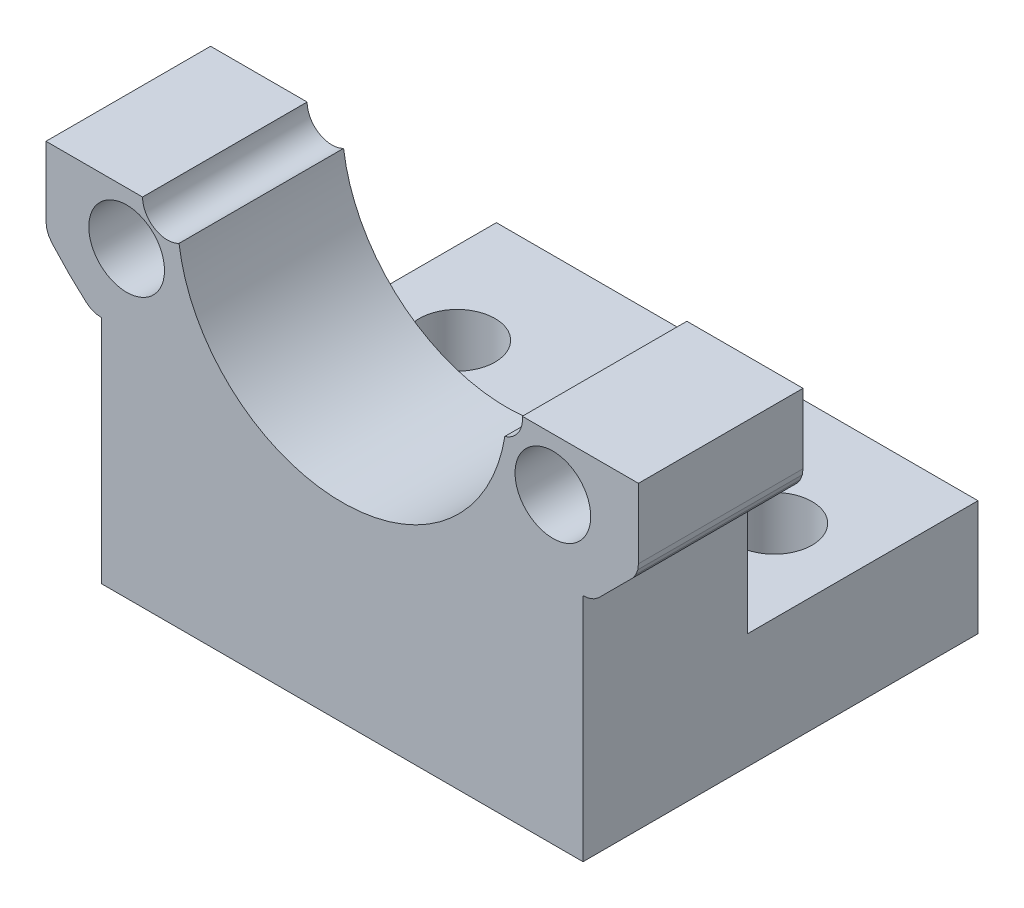
from build123d import *

# Parameters (mm, degrees)
FACE_2_DEPTH            = 5
SKETCH2_W               = 14.632926246
SKETCH2_H               = 5
BOSS_EXTRUDE2_DEPTH     = 7
SKETCH3_W               = 14.632926246
SKETCH3_H               = 7
BOSS_EXTRUDE3_DEPTH     = 7
EYE_HOLES_REACH         = 248.075
SKETCH4_R               = 1.15
SKETCH5_W               = 14.632926246
SKETCH5_H               = 3.5
SEAT_DEPTH              = 7
SKETCH6_W               = 18
SKETCH6_H               = 5
BOSS_EXTRUDE4_DEPTH     = 3.5
SKETCH7_W               = 18.025006546
SKETCH7_H               = 4.25
TOP_HOLE_DEPTH          = 248.972829901
MIDDLE_HOLE_DEPTH       = 246.672789516
MIDDLE_HOLE_DEPTH_BACK  = 246.672789516
SKETCH8_R               = 5.003684601
CUT_EXTRUDE8_DEPTH      = 208.598432106
CUT_EXTRUDE8_DEPTH_BACK = 3.5
SKETCH10_R              = 1.15
SKETCH11_R              = 0.754398486
CUT_EXTRUDE9_DEPTH      = 246.672789516


with BuildPart() as part:
    # Sketch1 → Face 2 (new body)
    with BuildSketch(Plane.XY):
        Polygon((189.199131389, 129.336090234), (189.219408928, 129.168352428), (189.276625012, 129.01501095), (189.375109043, 128.870497126), (189.879763338, 128.333185306), (190.417075159, 127.828531011), (190.558185088, 127.731803407), (190.715733881, 127.672634267), (190.882668266, 127.652553357), (205.515594512, 127.652553357), (205.683332318, 127.672830896), (205.84007769, 127.731803407), (205.98118762, 127.828531011), (207.023153735, 128.870497126), (207.118523911, 129.009007135), (207.17885385, 129.168352428), (207.199131389, 129.336090234), (207.199131389, 132.202042434), (189.199131389, 132.202042434), align=None)
    extrude(amount=FACE_2_DEPTH)

    # Sketch2 → Boss-Extrude2 (add)
    with BuildSketch(Plane.XZ.offset(-127.652553357)):
        with Locations((198.199131389, 2.5)):
            Rectangle(SKETCH2_W, SKETCH2_H)
    extrude(amount=BOSS_EXTRUDE2_DEPTH)

    # Sketch3 → Boss-Extrude3 (add)
    with BuildSketch(Plane(origin=(0, 0, 0), x_dir=(-1, 0, 0), z_dir=(0, 0, -1))):
        with Locations((-198.199131389, 124.152553357)):
            Rectangle(SKETCH3_W, SKETCH3_H)
    extrude(amount=BOSS_EXTRUDE3_DEPTH)

    # Sketch4 → Eye Holes (cut, up to next)
    with BuildSketch(Plane.XY.offset(5), mode=Mode.PRIVATE) as eye_holes_sk1:
        with Locations((191.649131389, 129.852042434)):
            Circle(SKETCH4_R)
    eye_holes_tool1 = extrude(eye_holes_sk1.sketch, amount=-EYE_HOLES_REACH, mode=Mode.PRIVATE) & part.part
    # Sketch4 → Eye Holes (cut, up to next)
    with BuildSketch(Plane.XY.offset(5), mode=Mode.PRIVATE) as eye_holes_sk2:
        with Locations((204.599131389, 129.852042434)):
            Circle(SKETCH4_R)
    eye_holes_tool2 = extrude(eye_holes_sk2.sketch, amount=-EYE_HOLES_REACH, mode=Mode.PRIVATE) & part.part
    add(eye_holes_tool1.solids().sort_by_distance((191.649131, 129.852042, 5))[0], mode=Mode.SUBTRACT)
    add(eye_holes_tool2.solids().sort_by_distance((204.599131, 129.852042, 5))[0], mode=Mode.SUBTRACT)

    # Sketch5 → Seat (cut)
    with BuildSketch(Plane(origin=(0, 0, -7), x_dir=(-1, 0, 0), z_dir=(0, 0, -1))):
        with Locations((-198.199131389, 125.902553357)):
            Rectangle(SKETCH5_W, SKETCH5_H)
    extrude(amount=-SEAT_DEPTH, mode=Mode.SUBTRACT)

    # Sketch6 → Boss-Extrude4 (add)
    with BuildSketch(Plane(origin=(0, 132.202042434, 0), x_dir=(1, 0, 0), z_dir=(0, 1, 0))):
        with Locations((198.199131389, -2.5)):
            Rectangle(SKETCH6_W, SKETCH6_H)
    extrude(amount=BOSS_EXTRUDE4_DEPTH)

    # Sketch7 → Top Hole (cut, through all)
    with BuildSketch(Plane.XY.offset(5)):
        with Locations((198.194207579, 133.577042434)):
            Rectangle(SKETCH7_W, SKETCH7_H)
    extrude(amount=-TOP_HOLE_DEPTH, mode=Mode.SUBTRACT)

    # Sketch8 → Middle Hole (cut, two sides: drawn at the far end of the back side and taken through both)
    with BuildSketch(Plane.XY.offset(5).offset(-MIDDLE_HOLE_DEPTH_BACK)):
        with Locations((198.199131389, 131.452042434)):
            Circle(SKETCH8_R)
    extrude(amount=MIDDLE_HOLE_DEPTH + MIDDLE_HOLE_DEPTH_BACK, mode=Mode.SUBTRACT)

    # Sketch10 → Cut-Extrude8 (cut, two sides: drawn at the far end of the back side and taken through both)
    with BuildSketch(Plane.XZ.offset(-120.652553357).offset(-CUT_EXTRUDE8_DEPTH_BACK)):
        with Locations((193.382668266, -3.308334882)):
            Circle(SKETCH10_R)
        with Locations((203.015594512, -3.308334882)):
            Circle(SKETCH10_R)
    extrude(amount=CUT_EXTRUDE8_DEPTH + CUT_EXTRUDE8_DEPTH_BACK, mode=Mode.SUBTRACT)

    # Sketch11 → Cut-Extrude9 (cut, through all)
    with BuildSketch(Plane.XY.offset(5)):
        with Locations((192.88691871, 131.452042434)):
            Circle(SKETCH11_R)
        with Locations((202.919958348, 131.377258625)):
            Circle(SKETCH11_R)
    extrude(amount=-CUT_EXTRUDE9_DEPTH, mode=Mode.SUBTRACT)


solid = part.part
